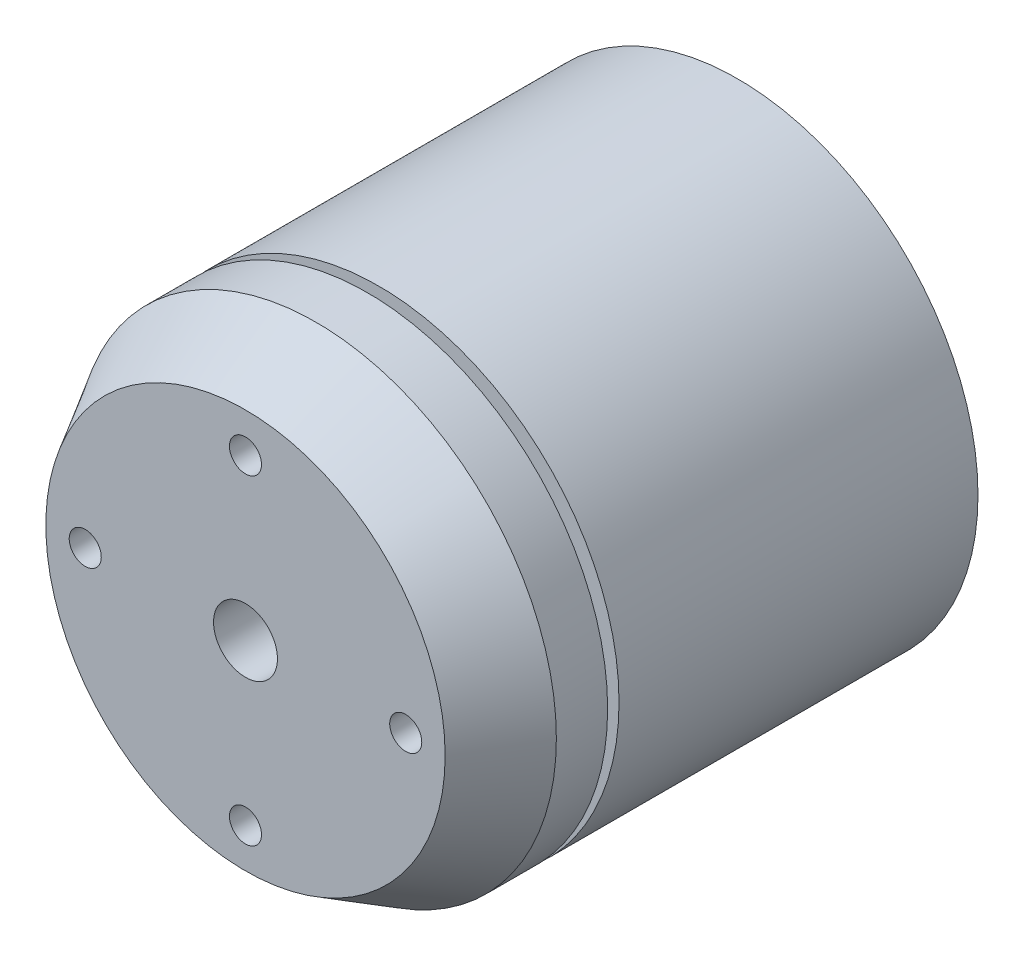
from build123d import *

# Parameters (mm, degrees)
M3X0_5_TAPPED_HOLE1_D     = 2.5
M3X0_5_TAPPED_HOLE1_DEPTH = 7.62
M3X0_5_TAPPED_HOLE1_TIP   = 0.751075774
CUT_EXTRUDE1_REACH        = 54.879
SKETCH5_R                 = 2.49301


with BuildPart() as part:
    # Sketch1 → Revolve1 (revolve)
    with BuildSketch(Plane(origin=(0, 0, 0), x_dir=(0, 0, -1), z_dir=(1, 0, 0)), mode=Mode.PRIVATE) as revolve1_sk:
        Polygon((0, 15.574573519), (0, 0), (45.75, 0), (45.75, 2.49), (45.75, 6), (39.75, 6), (38.389, 18.75), (10.389, 18.75), (10.389, 14.2875), (9.5, 14.2875), (9.5, 18.75), (5.5, 18.75), align=None)
    revolve(revolve1_sk.sketch.rotate(Axis((0, 0, 0), (0, 0, -1)), 90), axis=Axis((0, 0, 0), (0, 0, -1)))

    # M3x0.5 Tapped Hole1
    with Locations(Plane.XY):
        with Locations((0, 12.5), (12.5, 0), (-12.5, 0), (0, -12.5)):
            Hole(M3X0_5_TAPPED_HOLE1_D / 2, depth=M3X0_5_TAPPED_HOLE1_DEPTH)
            with Locations((0, 0, -(M3X0_5_TAPPED_HOLE1_DEPTH + M3X0_5_TAPPED_HOLE1_TIP / 2))):  # 118° drill point
                Cone(0, M3X0_5_TAPPED_HOLE1_D / 2, M3X0_5_TAPPED_HOLE1_TIP, mode=Mode.SUBTRACT)

    # Sketch5 → Cut-Extrude1 (cut, up to next)
    with BuildSketch(Plane.XY, mode=Mode.PRIVATE) as cut_extrude1_sk1:
        Circle(SKETCH5_R)
    cut_extrude1_tool1 = extrude(cut_extrude1_sk1.sketch, amount=-CUT_EXTRUDE1_REACH, mode=Mode.PRIVATE) & part.part
    add(cut_extrude1_tool1.solids().sort_by_distance((0, 0, 0))[0], mode=Mode.SUBTRACT)


solid = part.part
